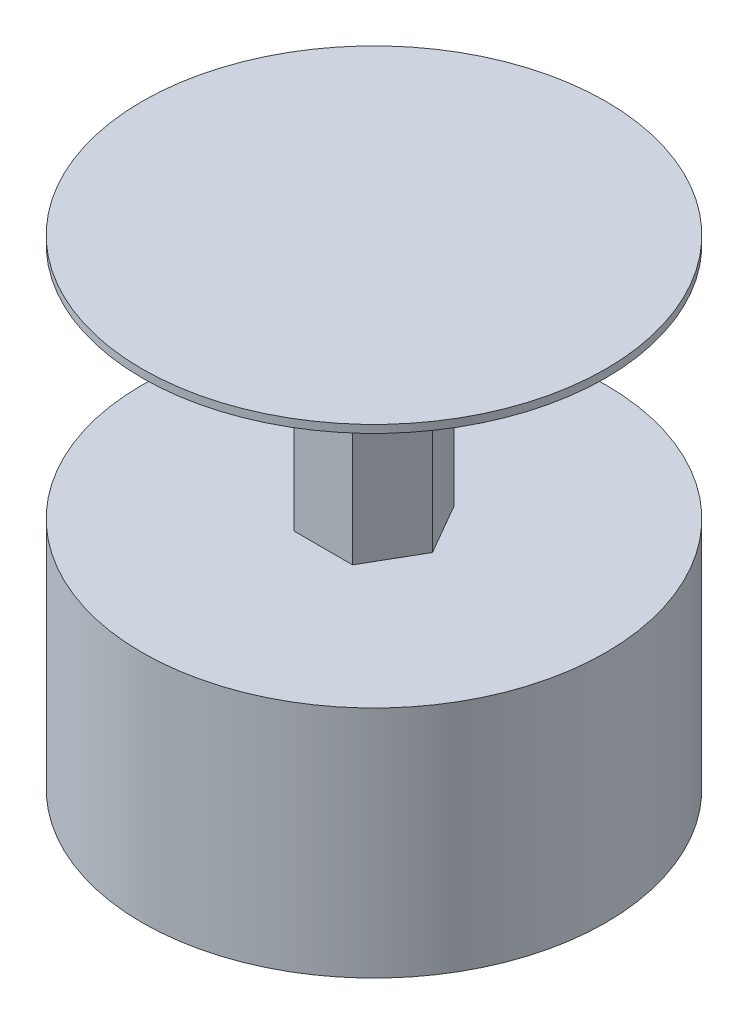
from build123d import *

# Parameters (mm, degrees)
SKETCH1_R           = 297.326212148
BOSS_EXTRUDE1_DEPTH = 10
BOSS_EXTRUDE2_DEPTH = 305
BOSS_EXTRUDE3_START = 300
SKETCH3_R           = 297.326212148
BOSS_EXTRUDE3_DEPTH = 300
SKETCH5_R           = 5
CUT_EXTRUDE1_DEPTH  = 10
SKETCH6_R           = 5
CUT_EXTRUDE2_DEPTH  = 10


with BuildPart() as part:
    # Sketch1 → Boss-Extrude1 (new body)
    with BuildSketch(Plane(origin=(0, 0, 0), x_dir=(1, 0, 0), z_dir=(0, 1, 0))):
        with Locations(Location((0, 0, 0), (0, 0, 270))):
            Circle(SKETCH1_R)
    extrude(amount=BOSS_EXTRUDE1_DEPTH)

    # Sketch2 → Boss-Extrude2 (add)
    with BuildSketch(Plane.XZ):
        Polygon((75, 0), (37.5, 64.951905284), (-37.5, 64.951905284), (-75, 0), (-37.5, -64.951905284), (37.5, -64.951905284), align=None)
    extrude(amount=BOSS_EXTRUDE2_DEPTH)

    # Sketch3 → Boss-Extrude3 (add)
    with BuildSketch(Plane.XZ.offset(305).offset(BOSS_EXTRUDE3_START)):
        with Locations(Location((0, 0, 0), (0, 0, 90))):
            Circle(SKETCH3_R)
    extrude(amount=-BOSS_EXTRUDE3_DEPTH)

    # Sketch5 → Cut-Extrude1 (cut)
    with BuildSketch(Plane.XZ.offset(605)):
        with Locations(Location((150, 0, 0), (0, 0, 270))):
            Circle(SKETCH5_R)
        with Locations(Location((-150, 0, 0), (0, 0, 90))):
            Circle(SKETCH5_R)
    extrude(amount=-CUT_EXTRUDE1_DEPTH, mode=Mode.SUBTRACT)

    # Sketch6 → Cut-Extrude2 (cut)
    with BuildSketch(Plane.XZ.offset(605)):
        with Locations(Location((0, 259.826212148, 0), (0, 0, 270))):
            Circle(SKETCH6_R)
        with Locations(Location((0, -259.826212148, 0), (0, 0, 90))):
            Circle(SKETCH6_R)
    extrude(amount=-CUT_EXTRUDE2_DEPTH, mode=Mode.SUBTRACT)


solid = part.part
